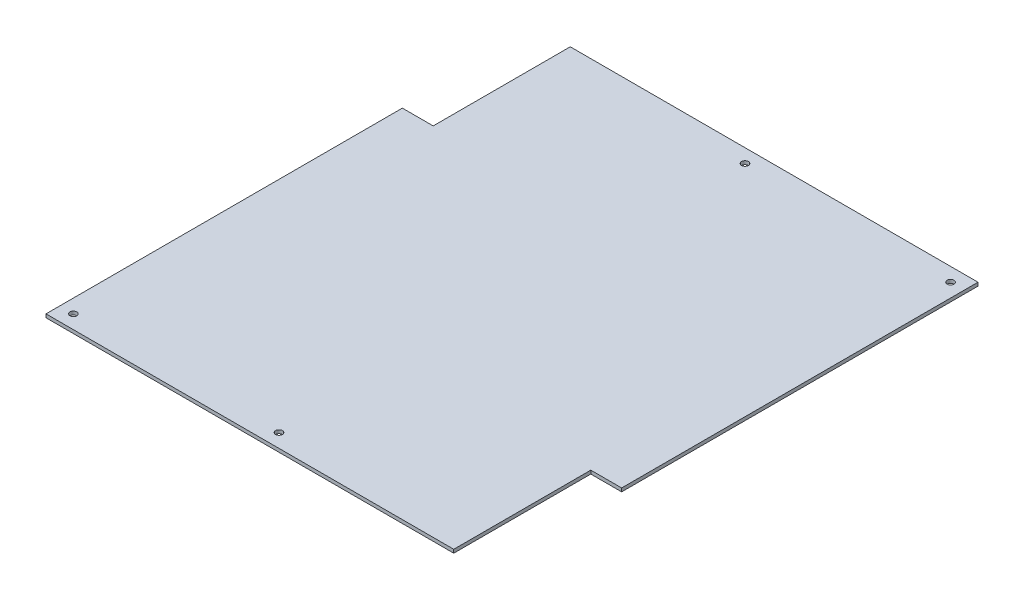
from build123d import *

# Parameters (mm, degrees)
SKETCH1_W                   = 406.4
SKETCH1_H                   = 457.2
BOSS_EXTRUDE1_DEPTH         = 3.175
CUT_EXTRUDE1_REACH          = 307.873
SKETCH2_W                   = 28.575
SKETCH2_H                   = 127
F_1_4_0_25_DIAMETER_HOLE1_D = 6.35


with BuildPart() as part:
    # Sketch1 → Boss-Extrude1 (new body)
    with BuildSketch(Plane(origin=(0, 0, 0), x_dir=(1, 0, 0), z_dir=(0, 1, 0))):
        Rectangle(SKETCH1_W, SKETCH1_H)
    extrude(amount=BOSS_EXTRUDE1_DEPTH)

    # Sketch2 → Cut-Extrude1 (cut, up to next)
    with BuildSketch(Plane(origin=(0, 3.175, 0), x_dir=(1, 0, 0), z_dir=(0, 1, 0)), mode=Mode.PRIVATE) as cut_extrude1_sk1:
        with Locations((-188.9125, 165.1)):
            Rectangle(SKETCH2_W, SKETCH2_H)
    cut_extrude1_tool1 = extrude(cut_extrude1_sk1.sketch, amount=-CUT_EXTRUDE1_REACH, mode=Mode.PRIVATE) & part.part
    # Sketch2 → Cut-Extrude1 (cut, up to next)
    with BuildSketch(Plane(origin=(0, 3.175, 0), x_dir=(1, 0, 0), z_dir=(0, 1, 0)), mode=Mode.PRIVATE) as cut_extrude1_sk2:
        with Locations((188.9125, -165.1)):
            Rectangle(SKETCH2_W, SKETCH2_H)
    cut_extrude1_tool2 = extrude(cut_extrude1_sk2.sketch, amount=-CUT_EXTRUDE1_REACH, mode=Mode.PRIVATE) & part.part
    add(cut_extrude1_tool1.solids().sort_by_distance((-188.9125, 3.175, -165.1))[0], mode=Mode.SUBTRACT)
    add(cut_extrude1_tool2.solids().sort_by_distance((188.9125, 3.175, 165.1))[0], mode=Mode.SUBTRACT)

    # 1/4 (0.25) Diameter Hole1 (through all)
    with Locations(Plane(origin=(0, 3.175, 0), x_dir=(1, 0, 0), z_dir=(0, 1, 0))):
        with Locations((-190.5, -215.9), (190.5, 215.9), (0, 215.9), (0, -215.9)):
            Hole(F_1_4_0_25_DIAMETER_HOLE1_D / 2)


solid = part.part
